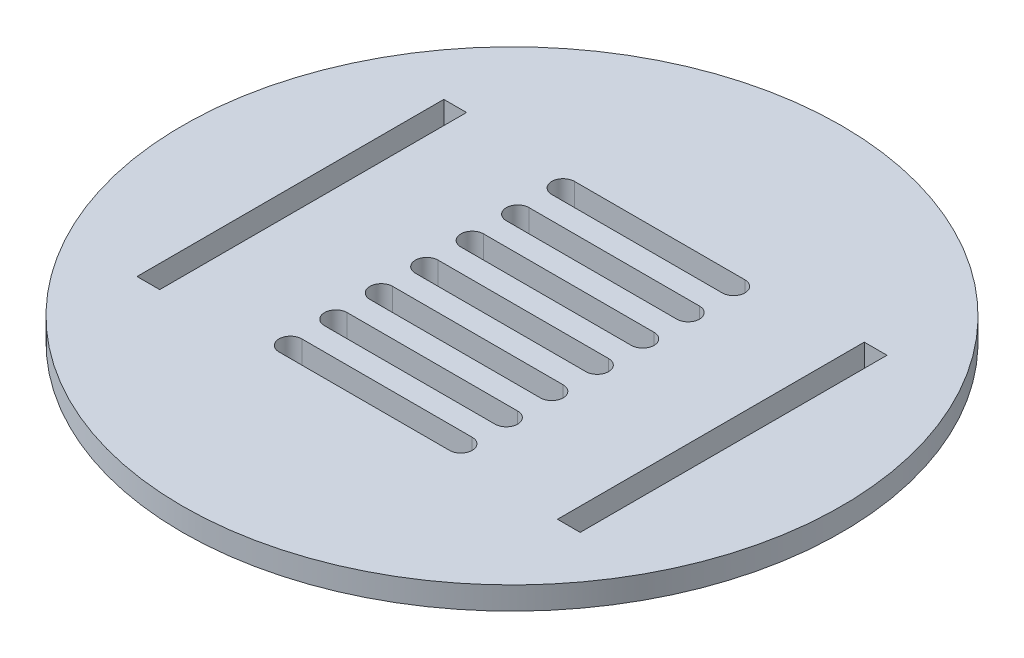
from build123d import *

# Parameters (mm, degrees)
SKETCH1_R           = 58
BOSS_EXTRUDE1_DEPTH = 4
SKETCH2_W           = 4
SKETCH2_H           = 54
CUT_EXTRUDE1_DEPTH  = 83.121860671
CUT_EXTRUDE2_DEPTH  = 4


with BuildPart() as part:
    # Sketch1 → Boss-Extrude1 (new body)
    with BuildSketch(Plane(origin=(0, 0, 0), x_dir=(1, 0, 0), z_dir=(0, 1, 0))):
        with Locations(Location((0, 0, 0), (0, 0, 270))):
            Circle(SKETCH1_R)
    extrude(amount=BOSS_EXTRUDE1_DEPTH)

    # Sketch2 → Cut-Extrude1 (cut, through all)
    with BuildSketch(Plane(origin=(0, 4, 0), x_dir=(1, 0, 0), z_dir=(0, 1, 0))):
        with Locations((37, 0)):
            Rectangle(SKETCH2_W, SKETCH2_H)
        with Locations((-37, 0)):
            Rectangle(SKETCH2_W, SKETCH2_H)
    extrude(amount=-CUT_EXTRUDE1_DEPTH, mode=Mode.SUBTRACT)

    # Sketch3 → Cut-Extrude2 (cut)
    with BuildSketch(Plane(origin=(0, 4, 0), x_dir=(1, 0, 0), z_dir=(0, 1, 0))):
        with BuildLine():
            Line((-15, 6), (15, 6))
            ThreePointArc((15, 6), (17, 8), (15, 10))
            Line((15, 10), (-15, 10))
            ThreePointArc((-15, 10), (-17, 8), (-15, 6))
        make_face()
        with BuildLine():
            Line((-15, 14), (15, 14))
            ThreePointArc((15, 14), (17, 16), (15, 18))
            Line((15, 18), (-15, 18))
            ThreePointArc((-15, 18), (-17, 16), (-15, 14))
        make_face()
        with BuildLine():
            Line((-15, -10), (15, -10))
            ThreePointArc((15, -10), (17, -8), (15, -6))
            Line((15, -6), (-15, -6))
            ThreePointArc((-15, -6), (-17, -8), (-15, -10))
        make_face()
        with BuildLine():
            Line((-15, -26), (15, -26))
            ThreePointArc((15, -26), (17, -24), (15, -22))
            Line((15, -22), (-15, -22))
            ThreePointArc((-15, -22), (-17, -24), (-15, -26))
        make_face()
        with BuildLine():
            Line((-15, 2), (15, 2))
            ThreePointArc((15, 2), (17, 0), (15, -2))
            Line((15, -2), (-15, -2))
            ThreePointArc((-15, -2), (-17, 0), (-15, 2))
        make_face()
        with BuildLine():
            Line((-15, 26), (15, 26))
            ThreePointArc((15, 26), (17, 24), (15, 22))
            Line((15, 22), (-15, 22))
            ThreePointArc((-15, 22), (-17, 24), (-15, 26))
        make_face()
        with BuildLine():
            Line((-15, -14), (15, -14))
            ThreePointArc((15, -14), (17, -16), (15, -18))
            Line((15, -18), (-15, -18))
            ThreePointArc((-15, -18), (-17, -16), (-15, -14))
        make_face()
    extrude(amount=-CUT_EXTRUDE2_DEPTH, mode=Mode.SUBTRACT)


solid = part.part
